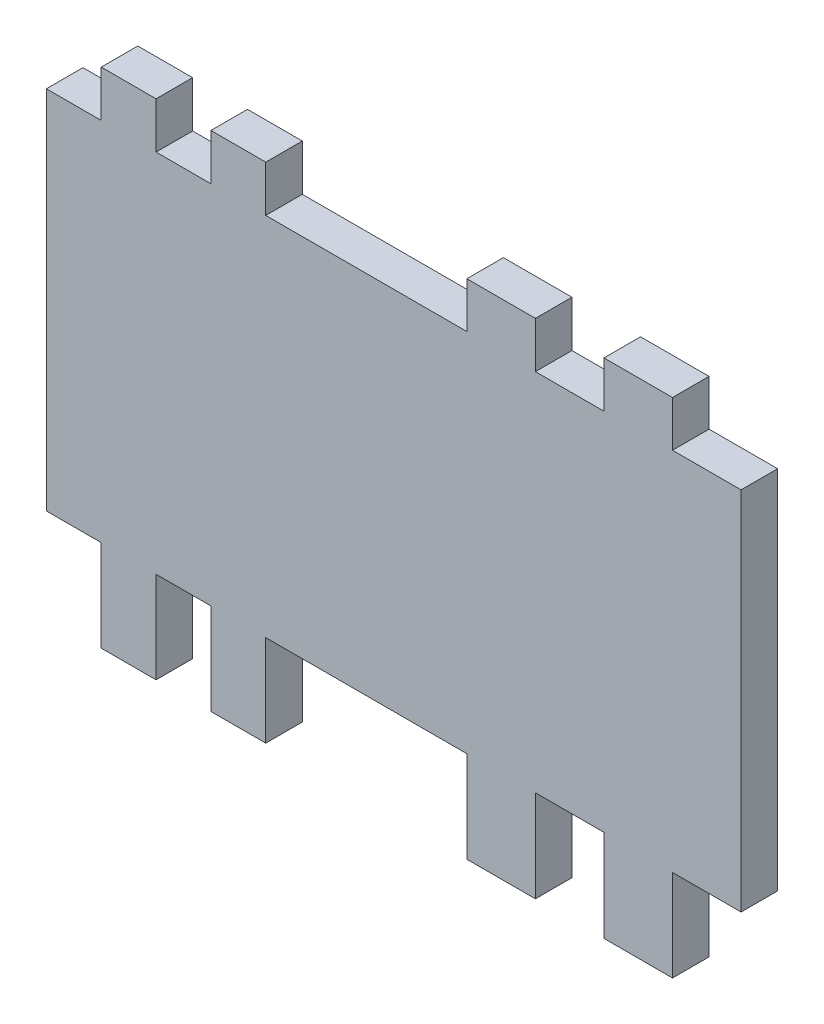
from build123d import *

# Parameters (mm, degrees)
BOSS_EXTRUDE1_DEPTH = 4


with BuildPart() as part:
    # Sketch1 → Boss-Extrude1 (new body)
    with BuildSketch(Plane.XY):
        Polygon((26.989795918, 13.545918367), (19.489795918, 13.545918367), (19.489795918, 18.545918367), (11.989795918, 18.545918367), (11.989795918, 13.494897959), (4.489795918, 13.494897959), (4.489795918, 18.545918367), (-3.010204082, 18.545918367), (-3.010204082, 13.545918367), (-25.010204082, 13.545918367), (-25.010204082, 18.596938776), (-31.010204082, 18.596938776), (-31.010204082, 13.545918367), (-37.010204082, 13.545918367), (-37.010204082, 18.596938776), (-43.010204082, 18.596938776), (-43.010204082, 13.545918367), (-49.010204082, 13.545918367), (-49.010204082, -26.454081633), (-43.010204082, -26.454081633), (-43.010204082, -31.505102041), (-43.010204082, -36.454081633), (-37.010204082, -36.454081633), (-37.010204082, -31.505102041), (-37.010204082, -26.454081633), (-31.010204082, -26.454081633), (-31.010204082, -31.505102041), (-31.010204082, -36.454081633), (-25.010204082, -36.454081633), (-25.010204082, -31.505102041), (-25.010204082, -26.454081633), (-3.010204082, -26.454081633), (-3.010204082, -31.454081633), (-3.010204082, -36.454081633), (4.489795918, -36.454081633), (4.489795918, -31.454081633), (4.489795918, -26.403061224), (11.989795918, -26.403061224), (11.989795918, -31.454081633), (11.989795918, -36.454081633), (19.489795918, -36.454081633), (19.489795918, -31.454081633), (19.489795918, -26.454081633), (26.989795918, -26.454081633), align=None)
    extrude(amount=BOSS_EXTRUDE1_DEPTH)


solid = part.part
